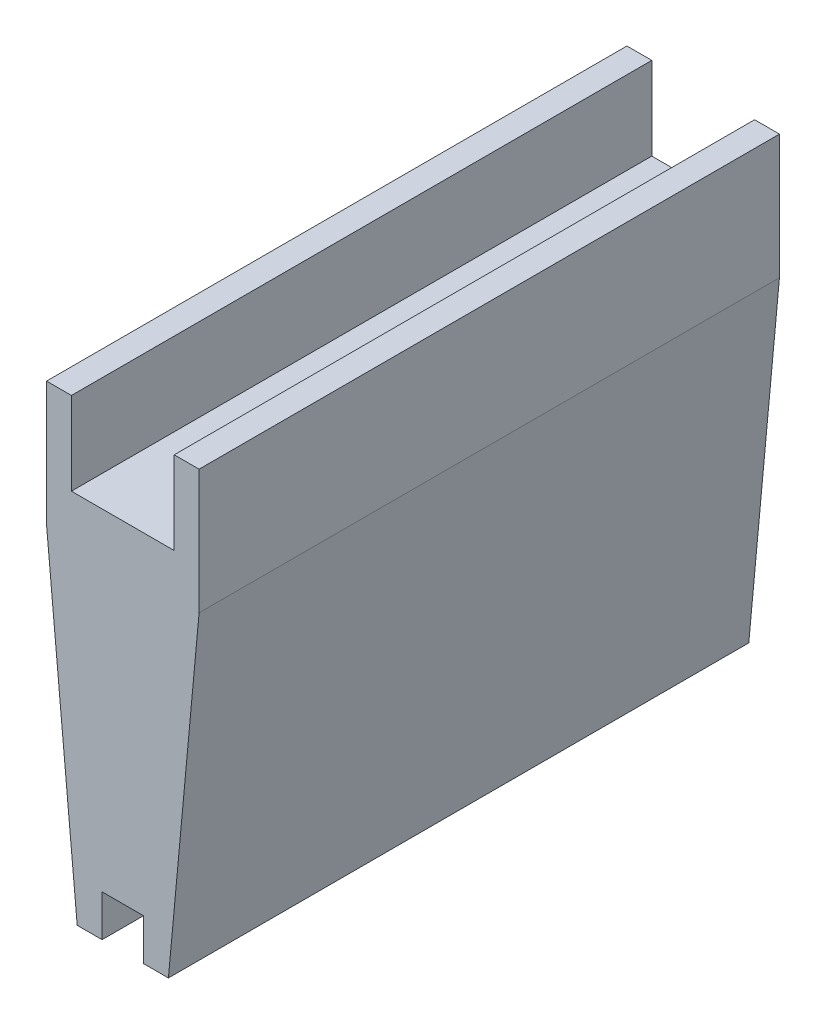
from build123d import *

# Parameters (mm, degrees)
BOSS_EXTRUDE1_DEPTH = 70
CHAMFER1_SIZE       = 40
CHAMFER1_SIZE2      = 3.7
CHAMFER2_SIZE       = 3.7
CHAMFER2_SIZE2      = 40


with BuildPart() as part:
    # Sketch1 → Boss-Extrude1 (new body)
    with BuildSketch(Plane.XY):
        Polygon((0, 0), (0, 55), (3, 55), (3, 45), (15.4, 45), (15.4, 55), (18.4, 55), (18.4, 0), (11.7, 0), (11.7, 5), (6.7, 5), (6.7, 0), align=None)
    extrude(amount=BOSS_EXTRUDE1_DEPTH)

    # Chamfer1
    chamfer1_edges = [part.edges().sort_by_distance(p)[0] for p in [
        (0, 0, 35),
    ]]
    chamfer1_side = [part.faces().sort_by_distance(p)[0] for p in [
        (0, 27.5, 35),
    ]]
    chamfer(chamfer1_edges, length=CHAMFER1_SIZE, length2=CHAMFER1_SIZE2, reference=chamfer1_side[0])

    # Chamfer2
    chamfer2_edges = [part.edges().sort_by_distance(p)[0] for p in [
        (18.4, 0, 35),
    ]]
    chamfer2_side = [part.faces().sort_by_distance(p)[0] for p in [
        (15.05, 0, 35),
    ]]
    chamfer(chamfer2_edges, length=CHAMFER2_SIZE, length2=CHAMFER2_SIZE2, reference=chamfer2_side[0])


solid = part.part
